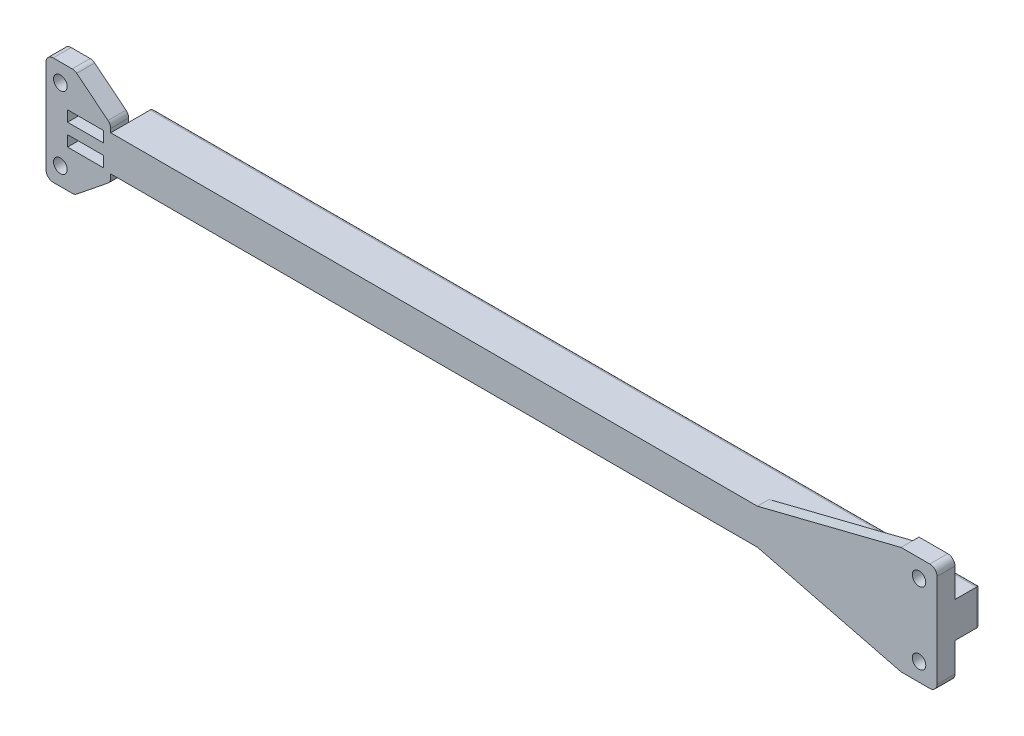
from build123d import *

# Parameters (mm, degrees)
SKETCH1_R           = 2.413
SKETCH1_R_2         = 2.38125
SKETCH1_W           = 12.7
SKETCH1_H           = 3.81
BOSS_EXTRUDE1_DEPTH = 3.175
SKETCH3_W           = 292.1
SKETCH3_H           = 12.573
BOSS_EXTRUDE2_DEPTH = 8.89
BOSS_EXTRUDE3_DEPTH = 4.1275
FILLET1_R           = 2.54
FILLET2_R           = 1.27


with BuildPart() as part:
    # Sketch1 → Boss-Extrude1 (new, symmetric)
    with BuildSketch(Plane.XY):
        Polygon((-292.1, -6.2865), (-12.7, -6.2865), (-12.7, -19.05), (0, -19.05), (0, 19.05), (-12.7, 19.05), (-12.7, 6.2865), (-292.1, 6.2865), (-292.1, 8.8265), (-304.8, 19.05), (-314.96, 19.05), (-314.96, -19.05), (-304.8, -19.05), (-292.1, -8.8265), align=None)
        with Locations((-309.88, -12.7)):
            Circle(SKETCH1_R, mode=Mode.SUBTRACT)
        with Locations(Location((-309.88, 12.7, 0), (0, 0, 180))):
            Circle(SKETCH1_R, mode=Mode.SUBTRACT)
        with Locations((-6.35, 12.7)):
            Circle(SKETCH1_R_2, mode=Mode.SUBTRACT)
        with Locations(Location((-6.35, -12.7, 0), (0, 0, 180))):
            Circle(SKETCH1_R_2, mode=Mode.SUBTRACT)
        with Locations((-300.99, 3.81)):
            Rectangle(SKETCH1_W, SKETCH1_H, mode=Mode.SUBTRACT)
        with Locations((-300.99, -3.81)):
            Rectangle(SKETCH1_W, SKETCH1_H, mode=Mode.SUBTRACT)
    extrude(amount=BOSS_EXTRUDE1_DEPTH, both=True)

    # Sketch3 → Boss-Extrude2 (add)
    with BuildSketch(Plane(origin=(0, 0, -3.175), x_dir=(-1, 0, 0), z_dir=(0, 0, -1))):
        with Locations((146.05, 0)):
            Rectangle(SKETCH3_W, SKETCH3_H)
    extrude(amount=BOSS_EXTRUDE2_DEPTH)

    # Sketch4 → Boss-Extrude3 (add)
    with BuildSketch(Plane.XY.offset(3.175)):
        Polygon((-12.7, 19.05), (-63.5, 6.2865), (-12.7, 6.2865), align=None)
        Polygon((-12.7, -6.2865), (-12.7, -19.05), (-63.5, -6.2865), align=None)
    extrude(amount=-BOSS_EXTRUDE3_DEPTH)

    # Fillet1
    fillet1_edges = [part.edges().sort_by_distance(p)[0] for p in [
        (0, 19.05, 0),
        (0, -19.05, 0),
        (-292.1, -8.8265, 0),
        (-304.8, -19.05, 0),
        (-314.96, -19.05, 0),
        (-314.96, 19.05, 0),
        (-304.8, 19.05, 0),
        (-292.1, 8.8265, 0),
    ]]
    fillet(fillet1_edges, radius=FILLET1_R)

    # Fillet2
    fillet2_edges = [part.edges().sort_by_distance(p)[0] for p in [
        (0, 0, -12.065),
        (-146.05, -6.2865, -12.065),
        (-292.1, 0, -12.065),
        (-146.05, 6.2865, -12.065),
    ]]
    fillet(fillet2_edges, radius=FILLET2_R)


solid = part.part
